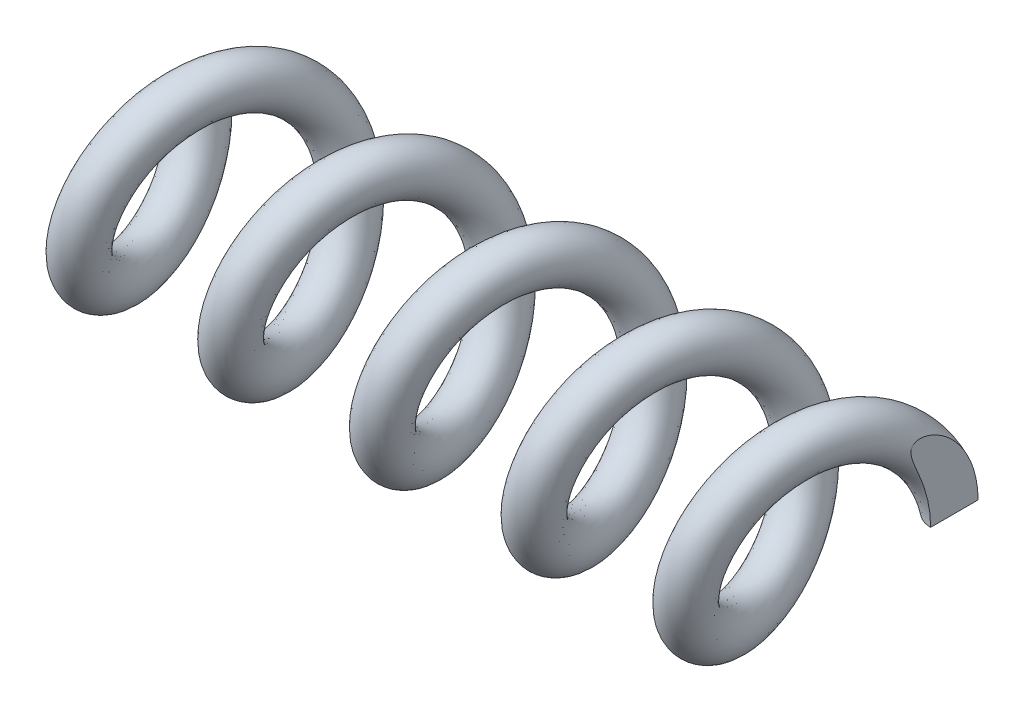
from build123d import *

# Parameters (mm, degrees)
SWEEP1_PITCH       = 6.4
SWEEP1_HEIGHT      = 32
SWEEP1_RADIUS      = 4
SWEEP1_START_ANGLE = 180
SKETCH4_R          = 1
SKETCH5_W          = 3.263183708
SKETCH5_H          = 7.544703556
CUT_EXTRUDE1_DEPTH = 10
SKETCH6_W          = 3.173798801
SKETCH6_H          = 6.175734461
CUT_EXTRUDE2_DEPTH = 10


with BuildPart() as part:
    # Sweep1: sweep along a helix
    with BuildLine() as sweep1_path:
        add(Helix(SWEEP1_PITCH, SWEEP1_HEIGHT, SWEEP1_RADIUS, center=(0, 0, 0), direction=(1, 0, 0), lefthand=True, mode=Mode.PRIVATE).rotate(Axis((0, 0, 0), (1, 0, 0)), SWEEP1_START_ANGLE))
    # Sketch4 → Sweep1 (sweep)
    with BuildSketch(Plane(origin=(0, 0, 0), x_dir=(1, 0, 0), z_dir=(0, 1, 0))):
        with Locations((0, 4)):
            Circle(SKETCH4_R)
    sweep(path=sweep1_path.line, is_frenet=True)

    # Sketch5 → Cut-Extrude1 (cut)
    with BuildSketch(Plane(origin=(0, 0, 0), x_dir=(1, 0, 0), z_dir=(0, 1, 0))):
        with Locations((-1.631591854, 1.227648222)):
            Rectangle(SKETCH5_W, SKETCH5_H)
    extrude(amount=-CUT_EXTRUDE1_DEPTH, mode=Mode.SUBTRACT)

    # Sketch6 → Cut-Extrude2 (cut)
    with BuildSketch(Plane.XZ):
        with Locations((33.586899401, -1.912132769)):
            Rectangle(SKETCH6_W, SKETCH6_H)
    extrude(amount=-CUT_EXTRUDE2_DEPTH, mode=Mode.SUBTRACT)


solid = part.part
